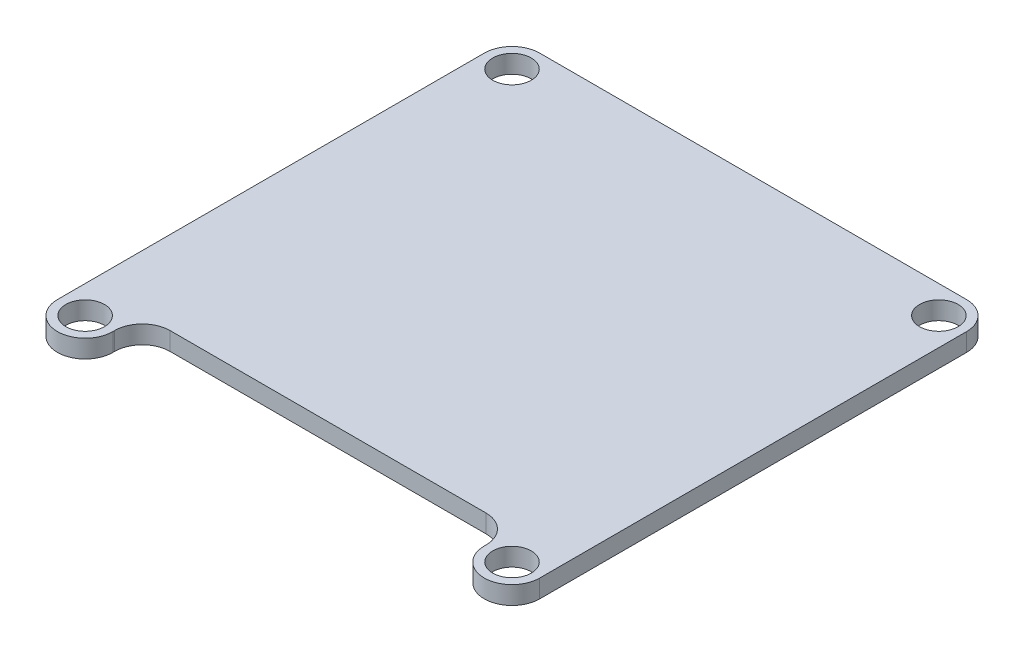
from build123d import *

# Parameters (mm, degrees)
BOSS_EXTRUDE1_DEPTH        = 1.5
F_3_2_3_2_DIAMETER_HOLE1_D = 3.2


with BuildPart() as part:
    # Sketch1 → Boss-Extrude1 (new body)
    with BuildSketch(Plane(origin=(0, 0, 0), x_dir=(1, 0, 0), z_dir=(0, 1, 0))):
        with BuildLine():
            Line((-18.944019139, 12.822966507), (16.455980861, 12.822966507))
            ThreePointArc((16.455980861, 12.822966507), (18.082326458, 12.149312104), (18.755980861, 10.522966507))
            Line((18.755980861, 10.522966507), (18.755980861, -24.877033493))
            ThreePointArc((18.755980861, -24.877033493), (18.082326458, -26.50337909), (16.455980861, -27.177033493))
            ThreePointArc((16.455980861, -27.177033493), (14.829635265, -26.50337909), (14.155980861, -24.877033493))
            Line((14.155980861, -24.877033493), (14.155980861, -24.733717149))
            ThreePointArc((14.155980861, -24.733717149), (13.482326458, -23.107371553), (11.855980861, -22.433717149))
            Line((11.855980861, -22.433717149), (-14.344019139, -22.433717149))
            ThreePointArc((-14.344019139, -22.433717149), (-15.970364735, -23.107371553), (-16.644019139, -24.733717149))
            Line((-16.644019139, -24.733717149), (-16.644019139, -24.877033493))
            ThreePointArc((-16.644019139, -24.877033493), (-17.317673542, -26.50337909), (-18.944019139, -27.177033493))
            ThreePointArc((-18.944019139, -27.177033493), (-20.570364735, -26.50337909), (-21.244019139, -24.877033493))
            Line((-21.244019139, -24.877033493), (-21.244019139, 10.522966507))
            ThreePointArc((-21.244019139, 10.522966507), (-20.570364735, 12.149312104), (-18.944019139, 12.822966507))
        make_face()
    extrude(amount=BOSS_EXTRUDE1_DEPTH)

    # Ø3.2 (3.2) Diameter Hole1 (through all)
    with Locations(Plane(origin=(0, 1.5, 0), x_dir=(1, 0, 0), z_dir=(0, 1, 0))):
        with Locations((-18.944019139, 10.522966507), (16.455980861, 10.522966507), (16.455980861, -24.877033493), (-18.944019139, -24.877033493)):
            Hole(F_3_2_3_2_DIAMETER_HOLE1_D / 2)


solid = part.part
